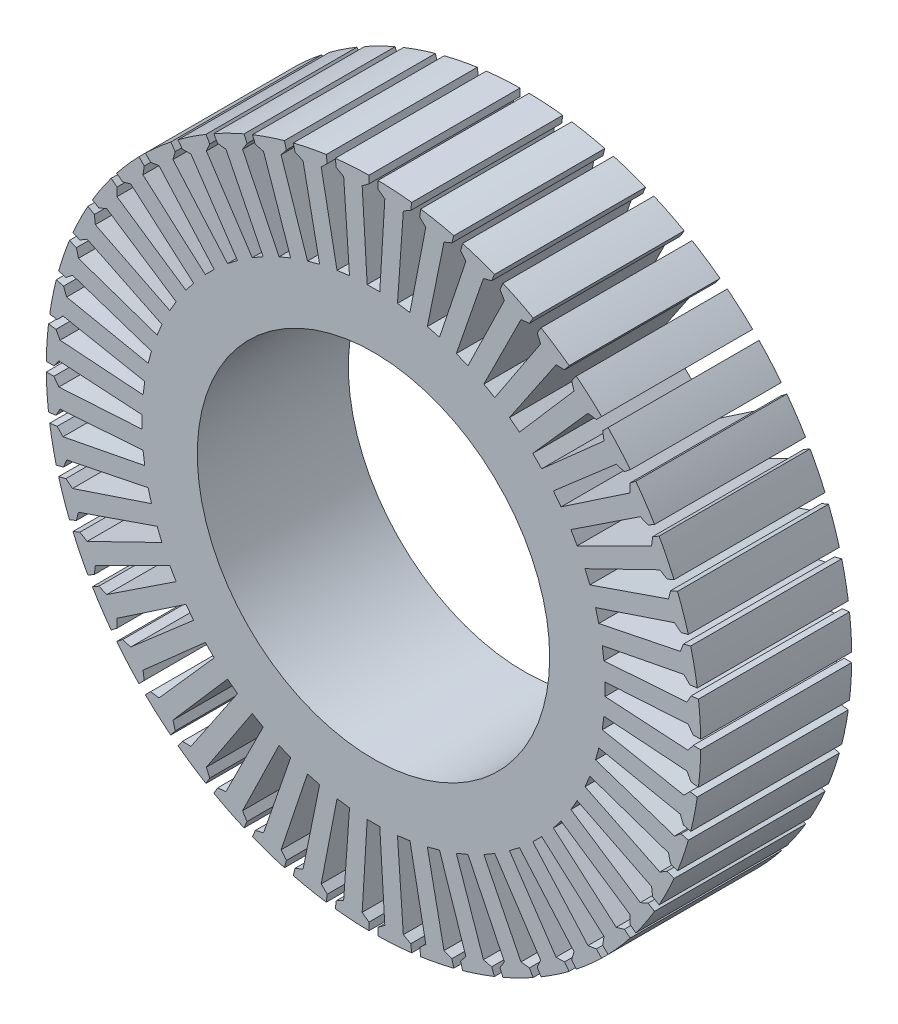
from build123d import *

# Parameters (mm, degrees)
STATOR_STACK_START    = -15
SKETCH_1_R            = 65
SKETCH_1_R_2          = 35
STATOR_STACK_DEPTH    = 30
STATOR_48_SLOTS_DEPTH = 16


with BuildPart() as part:
    # Эскиз1 → Stator_stack (new body)
    with BuildSketch(Plane.XY.offset(STATOR_STACK_START)):
        Circle(SKETCH_1_R)
        Circle(SKETCH_1_R_2, mode=Mode.SUBTRACT)
    extrude(amount=STATOR_STACK_DEPTH)

    # Эскиз2 → Stator_48_slots (cut, symmetric)
    with BuildSketch(Plane.XY):
        Polygon((65.993863351, -0.9), (63.5, -0.9), (62.5, -2.25), (46, -1.25), (46, 1.25), (62.5, 2.25), (63.5, 0.9), (65.993863351, 0.9), align=None)
        Polygon((65.546750275, 7.721627318), (63.07422227, 7.396112831), (62.258987768, 5.927136076), (45.769621363, 4.764898765), (45.443305883, 7.243510919), (61.671619903, 10.388637952), (62.839275124, 9.180713581), (65.311803129, 9.506228068), align=None)
        Polygon((63.978114128, 16.211135451), (61.56922711, 15.56567612), (60.952706995, 14.00285721), (44.756111816, 10.698268792), (44.109064203, 13.113083358), (59.788021292, 18.349523428), (61.103352829, 17.304342608), (63.512239847, 17.949801939), align=None)
        Polygon((61.314794711, 24.423266563), (59.010765404, 23.468906376), (58.603508505, 21.838985575), (42.976812786, 16.448588473), (42.020104205, 18.758287304), (56.881433059, 25.996443471), (58.321935225, 25.131889534), (60.625964532, 26.086249721), align=None)
        Polygon((57.602362156, 32.217508812), (55.44261314, 30.970577137), (55.251587737, 29.301442841), (40.462168574, 21.917468245), (39.212168574, 24.082531755), (53.001587737, 33.198557159), (54.54261314, 32.529422863), (56.702362156, 33.776354539), align=None)
        Polygon((52.904337214, 39.460500553), (50.925822395, 37.942332736), (50.954296983, 36.262544297), (37.25520544, 27.011334059), (35.733301867, 28.99471741), (48.214870553, 39.832634329), (49.830051822, 39.370368748), (51.808566642, 40.888536566), align=None)
        Polygon((47.301104395, 46.028312189), (45.537676708, 44.264884502), (45.785164082, 42.603183566), (33.410795411, 31.643028458), (31.643028458, 33.410795411), (42.603183566, 45.785164082), (44.264884502, 45.537676708), (46.028312189, 47.301104395), align=None)
        Polygon((40.888536566, 51.808566642), (39.370368748, 49.830051822), (39.832634329, 48.214870553), (28.99471741, 35.733301867), (27.011334059, 37.25520544), (36.262544297, 50.954296983), (37.942332736, 50.925822395), (39.460500553, 52.904337214), align=None)
        Polygon((33.776354539, 56.702362156), (32.529422863, 54.54261314), (33.198557159, 53.001587737), (24.082531755, 39.212168574), (21.917468245, 40.462168574), (29.301442841, 55.251587737), (30.970577137, 55.44261314), (32.217508812, 57.602362156), align=None)
        Polygon((26.086249721, 60.625964532), (25.131889534, 58.321935225), (25.996443471, 56.881433059), (18.758287304, 42.020104205), (16.448588473, 42.976812786), (21.838985575, 58.603508505), (23.468906376, 59.010765404), (24.423266563, 61.314794711), align=None)
        Polygon((17.949801939, 63.512239847), (17.304342608, 61.103352829), (18.349523428, 59.788021292), (13.113083358, 44.109064203), (10.698268792, 44.756111816), (14.00285721, 60.952706995), (15.56567612, 61.56922711), (16.211135451, 63.978114128), align=None)
        Polygon((9.506228068, 65.311803129), (9.180713581, 62.839275124), (10.388637952, 61.671619903), (7.243510919, 45.443305883), (4.764898765, 45.769621363), (5.927136076, 62.258987768), (7.396112831, 63.07422227), (7.721627318, 65.546750275), align=None)
        Polygon((0.9, 65.993863351), (0.9, 63.5), (2.25, 62.5), (1.25, 46), (-1.25, 46), (-2.25, 62.5), (-0.9, 63.5), (-0.9, 65.993863351), align=None)
        Polygon((-7.721627318, 65.546750275), (-7.396112831, 63.07422227), (-5.927136076, 62.258987768), (-4.764898765, 45.769621363), (-7.243510919, 45.443305883), (-10.388637952, 61.671619903), (-9.180713581, 62.839275124), (-9.506228068, 65.311803129), align=None)
        Polygon((-16.211135451, 63.978114128), (-15.56567612, 61.56922711), (-14.00285721, 60.952706995), (-10.698268792, 44.756111816), (-13.113083358, 44.109064203), (-18.349523428, 59.788021292), (-17.304342608, 61.103352829), (-17.949801939, 63.512239847), align=None)
        Polygon((-24.423266563, 61.314794711), (-23.468906376, 59.010765404), (-21.838985575, 58.603508505), (-16.448588473, 42.976812786), (-18.758287304, 42.020104205), (-25.996443471, 56.881433059), (-25.131889534, 58.321935225), (-26.086249721, 60.625964532), align=None)
        Polygon((-32.217508812, 57.602362156), (-30.970577137, 55.44261314), (-29.301442841, 55.251587737), (-21.917468245, 40.462168574), (-24.082531755, 39.212168574), (-33.198557159, 53.001587737), (-32.529422863, 54.54261314), (-33.776354539, 56.702362156), align=None)
        Polygon((-39.460500553, 52.904337214), (-37.942332736, 50.925822395), (-36.262544297, 50.954296983), (-27.011334059, 37.25520544), (-28.99471741, 35.733301867), (-39.832634329, 48.214870553), (-39.370368748, 49.830051822), (-40.888536566, 51.808566642), align=None)
        Polygon((-46.028312189, 47.301104395), (-44.264884502, 45.537676708), (-42.603183566, 45.785164082), (-31.643028458, 33.410795411), (-33.410795411, 31.643028458), (-45.785164082, 42.603183566), (-45.537676708, 44.264884502), (-47.301104395, 46.028312189), align=None)
        Polygon((-51.808566642, 40.888536566), (-49.830051822, 39.370368748), (-48.214870553, 39.832634329), (-35.733301867, 28.99471741), (-37.25520544, 27.011334059), (-50.954296983, 36.262544297), (-50.925822395, 37.942332736), (-52.904337214, 39.460500553), align=None)
        Polygon((-56.702362156, 33.776354539), (-54.54261314, 32.529422863), (-53.001587737, 33.198557159), (-39.212168574, 24.082531755), (-40.462168574, 21.917468245), (-55.251587737, 29.301442841), (-55.44261314, 30.970577137), (-57.602362156, 32.217508812), align=None)
        Polygon((-60.625964532, 26.086249721), (-58.321935225, 25.131889534), (-56.881433059, 25.996443471), (-42.020104205, 18.758287304), (-42.976812786, 16.448588473), (-58.603508505, 21.838985575), (-59.010765404, 23.468906376), (-61.314794711, 24.423266563), align=None)
        Polygon((-63.512239847, 17.949801939), (-61.103352829, 17.304342608), (-59.788021292, 18.349523428), (-44.109064203, 13.113083358), (-44.756111816, 10.698268792), (-60.952706995, 14.00285721), (-61.56922711, 15.56567612), (-63.978114128, 16.211135451), align=None)
        Polygon((-65.311803129, 9.506228068), (-62.839275124, 9.180713581), (-61.671619903, 10.388637952), (-45.443305883, 7.243510919), (-45.769621363, 4.764898765), (-62.258987768, 5.927136076), (-63.07422227, 7.396112831), (-65.546750275, 7.721627318), align=None)
        Polygon((-65.993863351, 0.9), (-63.5, 0.9), (-62.5, 2.25), (-46, 1.25), (-46, -1.25), (-62.5, -2.25), (-63.5, -0.9), (-65.993863351, -0.9), align=None)
        Polygon((-65.546750275, -7.721627318), (-63.07422227, -7.396112831), (-62.258987768, -5.927136076), (-45.769621363, -4.764898765), (-45.443305883, -7.243510919), (-61.671619903, -10.388637952), (-62.839275124, -9.180713581), (-65.311803129, -9.506228068), align=None)
        Polygon((-63.978114128, -16.211135451), (-61.56922711, -15.56567612), (-60.952706995, -14.00285721), (-44.756111816, -10.698268792), (-44.109064203, -13.113083358), (-59.788021292, -18.349523428), (-61.103352829, -17.304342608), (-63.512239847, -17.949801939), align=None)
        Polygon((-61.314794711, -24.423266563), (-59.010765404, -23.468906376), (-58.603508505, -21.838985575), (-42.976812786, -16.448588473), (-42.020104205, -18.758287304), (-56.881433059, -25.996443471), (-58.321935225, -25.131889534), (-60.625964532, -26.086249721), align=None)
        Polygon((-57.602362156, -32.217508812), (-55.44261314, -30.970577137), (-55.251587737, -29.301442841), (-40.462168574, -21.917468245), (-39.212168574, -24.082531755), (-53.001587737, -33.198557159), (-54.54261314, -32.529422863), (-56.702362156, -33.776354539), align=None)
        Polygon((-52.904337214, -39.460500553), (-50.925822395, -37.942332736), (-50.954296983, -36.262544297), (-37.25520544, -27.011334059), (-35.733301867, -28.99471741), (-48.214870553, -39.832634329), (-49.830051822, -39.370368748), (-51.808566642, -40.888536566), align=None)
        Polygon((-47.301104395, -46.028312189), (-45.537676708, -44.264884502), (-45.785164082, -42.603183566), (-33.410795411, -31.643028458), (-31.643028458, -33.410795411), (-42.603183566, -45.785164082), (-44.264884502, -45.537676708), (-46.028312189, -47.301104395), align=None)
        Polygon((-40.888536566, -51.808566642), (-39.370368748, -49.830051822), (-39.832634329, -48.214870553), (-28.99471741, -35.733301867), (-27.011334059, -37.25520544), (-36.262544297, -50.954296983), (-37.942332736, -50.925822395), (-39.460500553, -52.904337214), align=None)
        Polygon((-33.776354539, -56.702362156), (-32.529422863, -54.54261314), (-33.198557159, -53.001587737), (-24.082531755, -39.212168574), (-21.917468245, -40.462168574), (-29.301442841, -55.251587737), (-30.970577137, -55.44261314), (-32.217508812, -57.602362156), align=None)
        Polygon((-26.086249721, -60.625964532), (-25.131889534, -58.321935225), (-25.996443471, -56.881433059), (-18.758287304, -42.020104205), (-16.448588473, -42.976812786), (-21.838985575, -58.603508505), (-23.468906376, -59.010765404), (-24.423266563, -61.314794711), align=None)
        Polygon((-17.949801939, -63.512239847), (-17.304342608, -61.103352829), (-18.349523428, -59.788021292), (-13.113083358, -44.109064203), (-10.698268792, -44.756111816), (-14.00285721, -60.952706995), (-15.56567612, -61.56922711), (-16.211135451, -63.978114128), align=None)
        Polygon((-9.506228068, -65.311803129), (-9.180713581, -62.839275124), (-10.388637952, -61.671619903), (-7.243510919, -45.443305883), (-4.764898765, -45.769621363), (-5.927136076, -62.258987768), (-7.396112831, -63.07422227), (-7.721627318, -65.546750275), align=None)
        Polygon((-0.9, -65.993863351), (-0.9, -63.5), (-2.25, -62.5), (-1.25, -46), (1.25, -46), (2.25, -62.5), (0.9, -63.5), (0.9, -65.993863351), align=None)
        Polygon((7.721627318, -65.546750275), (7.396112831, -63.07422227), (5.927136076, -62.258987768), (4.764898765, -45.769621363), (7.243510919, -45.443305883), (10.388637952, -61.671619903), (9.180713581, -62.839275124), (9.506228068, -65.311803129), align=None)
        Polygon((16.211135451, -63.978114128), (15.56567612, -61.56922711), (14.00285721, -60.952706995), (10.698268792, -44.756111816), (13.113083358, -44.109064203), (18.349523428, -59.788021292), (17.304342608, -61.103352829), (17.949801939, -63.512239847), align=None)
        Polygon((24.423266563, -61.314794711), (23.468906376, -59.010765404), (21.838985575, -58.603508505), (16.448588473, -42.976812786), (18.758287304, -42.020104205), (25.996443471, -56.881433059), (25.131889534, -58.321935225), (26.086249721, -60.625964532), align=None)
        Polygon((32.217508812, -57.602362156), (30.970577137, -55.44261314), (29.301442841, -55.251587737), (21.917468245, -40.462168574), (24.082531755, -39.212168574), (33.198557159, -53.001587737), (32.529422863, -54.54261314), (33.776354539, -56.702362156), align=None)
        Polygon((39.460500553, -52.904337214), (37.942332736, -50.925822395), (36.262544297, -50.954296983), (27.011334059, -37.25520544), (28.99471741, -35.733301867), (39.832634329, -48.214870553), (39.370368748, -49.830051822), (40.888536566, -51.808566642), align=None)
        Polygon((46.028312189, -47.301104395), (44.264884502, -45.537676708), (42.603183566, -45.785164082), (31.643028458, -33.410795411), (33.410795411, -31.643028458), (45.785164082, -42.603183566), (45.537676708, -44.264884502), (47.301104395, -46.028312189), align=None)
        Polygon((51.808566642, -40.888536566), (49.830051822, -39.370368748), (48.214870553, -39.832634329), (35.733301867, -28.99471741), (37.25520544, -27.011334059), (50.954296983, -36.262544297), (50.925822395, -37.942332736), (52.904337214, -39.460500553), align=None)
        Polygon((56.702362156, -33.776354539), (54.54261314, -32.529422863), (53.001587737, -33.198557159), (39.212168574, -24.082531755), (40.462168574, -21.917468245), (55.251587737, -29.301442841), (55.44261314, -30.970577137), (57.602362156, -32.217508812), align=None)
        Polygon((60.625964532, -26.086249721), (58.321935225, -25.131889534), (56.881433059, -25.996443471), (42.020104205, -18.758287304), (42.976812786, -16.448588473), (58.603508505, -21.838985575), (59.010765404, -23.468906376), (61.314794711, -24.423266563), align=None)
        Polygon((63.512239847, -17.949801939), (61.103352829, -17.304342608), (59.788021292, -18.349523428), (44.109064203, -13.113083358), (44.756111816, -10.698268792), (60.952706995, -14.00285721), (61.56922711, -15.56567612), (63.978114128, -16.211135451), align=None)
        Polygon((65.311803129, -9.506228068), (62.839275124, -9.180713581), (61.671619903, -10.388637952), (45.443305883, -7.243510919), (45.769621363, -4.764898765), (62.258987768, -5.927136076), (63.07422227, -7.396112831), (65.546750275, -7.721627318), align=None)
    extrude(amount=STATOR_48_SLOTS_DEPTH, both=True, mode=Mode.SUBTRACT)


solid = part.part
